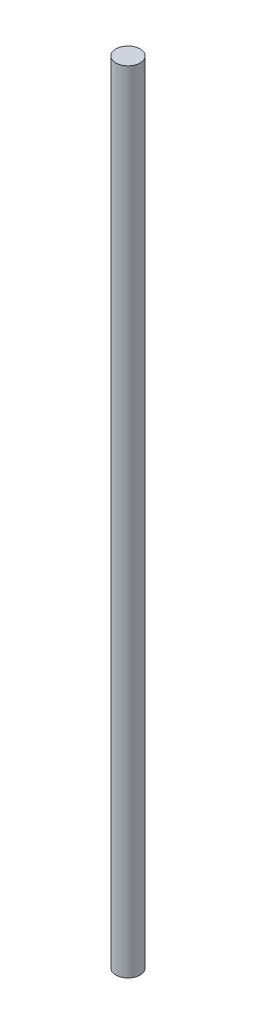
from build123d import *

# Parameters (mm, degrees)
CROQUIS1_R              = 10
SALIENTE_EXTRUIR1_DEPTH = 325


with BuildPart() as part:
    # Croquis1 → Saliente-Extruir1 (new, symmetric)
    with BuildSketch(Plane(origin=(0, 0, 0), x_dir=(1, 0, 0), z_dir=(0, 1, 0))):
        with Locations(Location((0, 0, 0), (0, 0, 270))):
            Circle(CROQUIS1_R)
    extrude(amount=SALIENTE_EXTRUIR1_DEPTH, both=True)


solid = part.part
